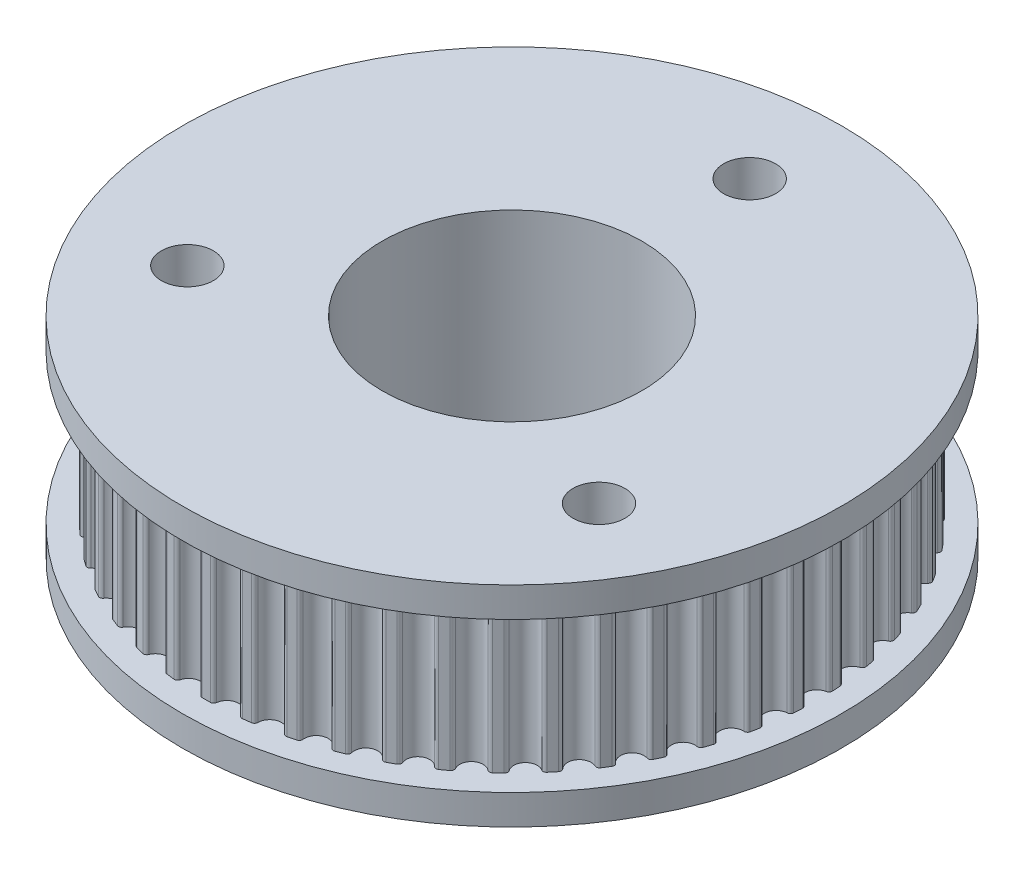
from build123d import *

# Parameters (mm, degrees)
MOUNTINGHOLES_R         = 39.751
BOSS_EXTRUDE1_DEPTH     = 9.525
CUT_EXTRUDE1_DEPTH      = 19.05
CIRPATTERN1_COUNT       = 50
FLANGE_R                = 41.91
BOSS_EXTRUDE2_DEPTH     = 3.81
BOSS_EXTRUDE3_START     = 3.81
SKETCH6_R               = 41.91
BOSS_EXTRUDE3_DEPTH     = 3.81
CUT_EXTRUDE5_DEPTH      = 32.512
CUT_EXTRUDE5_DEPTH_BACK = 31.242
SKETCH1_5_R             = 3.302
SKETCH1_5_R_2           = 16.51


with BuildPart() as part:
    # mountingHoles → Boss-Extrude1 (new, symmetric)
    with BuildSketch(Plane(origin=(0, 0, 0), x_dir=(1, 0, 0), z_dir=(0, 1, 0))):
        Circle(MOUNTINGHOLES_R)
    extrude(amount=BOSS_EXTRUDE1_DEPTH, both=True)

    # Sketch2 → Cut-Extrude1 (cut)
    with BuildSketch(Plane(origin=(0, 9.525, 0), x_dir=(1, 0, 0), z_dir=(0, 1, 0))):
        with BuildLine():
            Line((0, 38.8874), (0, 39.751))
            ThreePointArc((0, 39.751), (2.495985942, 39.672560482), (4.982121367, 39.437551492))
            Line((4.982121367, 39.437551492), (4.873883587, 38.580761236))
            ThreePointArc((4.873883587, 38.580761236), (4.614115167, 38.612689883), (4.354137743, 38.642869501))
            ThreePointArc((4.354137743, 38.642869501), (4.059877913, 38.568719188), (3.887072562, 38.319268939))
            ThreePointArc((3.887072562, 38.319268939), (2.339778754, 37.18971833), (0.94625605, 38.504289431))
            ThreePointArc((0.94625605, 38.504289431), (0.806077727, 38.773430944), (0.523431722, 38.883877096))
            ThreePointArc((0.523431722, 38.883877096), (0.261721789, 38.886519264), (0, 38.8874))
        make_face()
    cut_extrude1 = extrude(amount=-CUT_EXTRUDE1_DEPTH, mode=Mode.SUBTRACT)

    # CirPattern1: Cut-Extrude1 ×50 about axis
    cirpattern1_axis = Axis((0, 9.525, 0), (0, -1, 0))
    for i in range(1, CIRPATTERN1_COUNT):
        add(cut_extrude1.rotate(cirpattern1_axis, i * 360 / CIRPATTERN1_COUNT), mode=Mode.SUBTRACT)

    # flange → Boss-Extrude2 (add)
    with BuildSketch(Plane(origin=(0, 9.525, 0), x_dir=(1, 0, 0), z_dir=(0, 1, 0))):
        Circle(FLANGE_R)
    extrude(amount=BOSS_EXTRUDE2_DEPTH)

    # Sketch6 → Boss-Extrude3 (add)
    with BuildSketch(Plane.XZ.offset(9.525).offset(BOSS_EXTRUDE3_START)):
        Circle(SKETCH6_R)
    extrude(amount=-BOSS_EXTRUDE3_DEPTH)

    # Sketch1<5> → Cut-Extrude5 (cut, two sides: drawn at the far end of the back side and taken through both)
    with BuildSketch(Plane(origin=(0, 0, 0), x_dir=(1, 0, 0), z_dir=(0, 1, 0)).offset(-CUT_EXTRUDE5_DEPTH_BACK)):
        with Locations((0, 30.226)):
            Circle(SKETCH1_5_R)
        with Locations((26.176483855, -15.113)):
            Circle(SKETCH1_5_R)
        with Locations((-26.176483855, -15.113)):
            Circle(SKETCH1_5_R)
        Circle(SKETCH1_5_R_2)
    extrude(amount=CUT_EXTRUDE5_DEPTH + CUT_EXTRUDE5_DEPTH_BACK, mode=Mode.SUBTRACT)


solid = part.part
